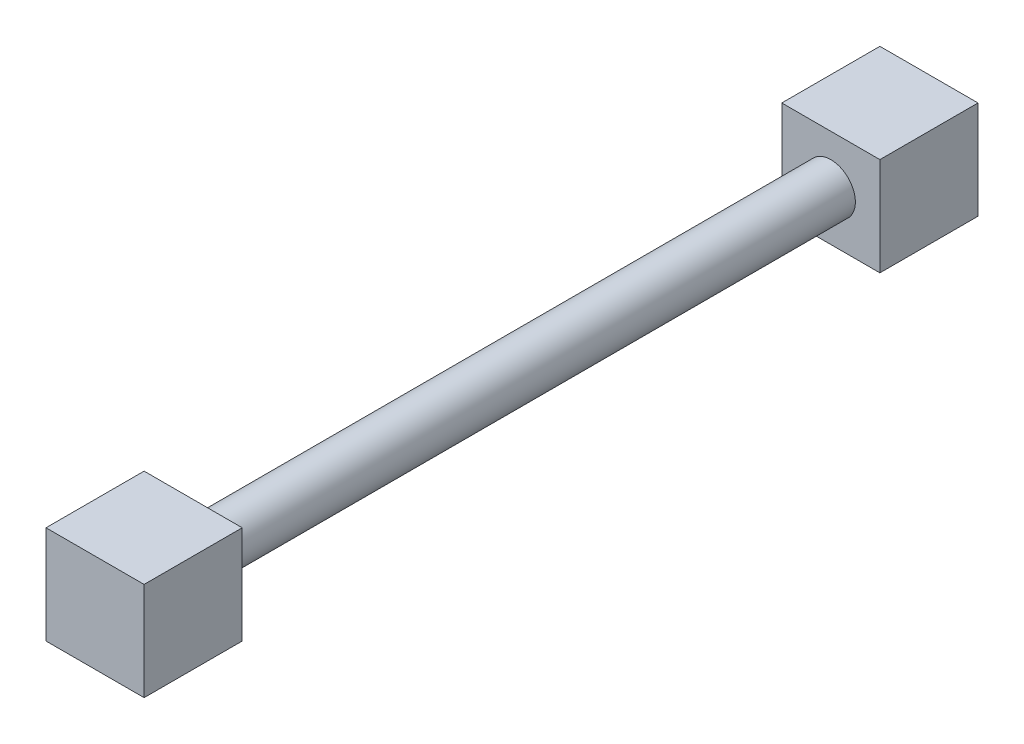
from build123d import *

# Parameters (mm, degrees)
SKETCH3_R           = 12.7
BOSS_EXTRUDE1_DEPTH = 381
SKETCH4_W           = 50.8
SKETCH4_H           = 50.8
BOSS_EXTRUDE2_DEPTH = 25.4
SKETCH5_W           = 50.8
SKETCH5_H           = 50.8
BOSS_EXTRUDE3_DEPTH = 25.4


with BuildPart() as part:
    # Sketch3 → Boss-Extrude1 (new body)
    with BuildSketch(Plane.XY):
        Circle(SKETCH3_R)
    extrude(amount=BOSS_EXTRUDE1_DEPTH)

    # Sketch4 → Boss-Extrude2 (add, symmetric)
    with BuildSketch(Plane(origin=(0, 0, 0), x_dir=(-1, 0, 0), z_dir=(0, 0, -1))):
        Rectangle(SKETCH4_W, SKETCH4_H)
    extrude(amount=BOSS_EXTRUDE2_DEPTH, both=True)

    # Sketch5 → Boss-Extrude3 (add, symmetric)
    with BuildSketch(Plane.XY.offset(381)):
        Rectangle(SKETCH5_W, SKETCH5_H)
    extrude(amount=BOSS_EXTRUDE3_DEPTH, both=True)


solid = part.part
